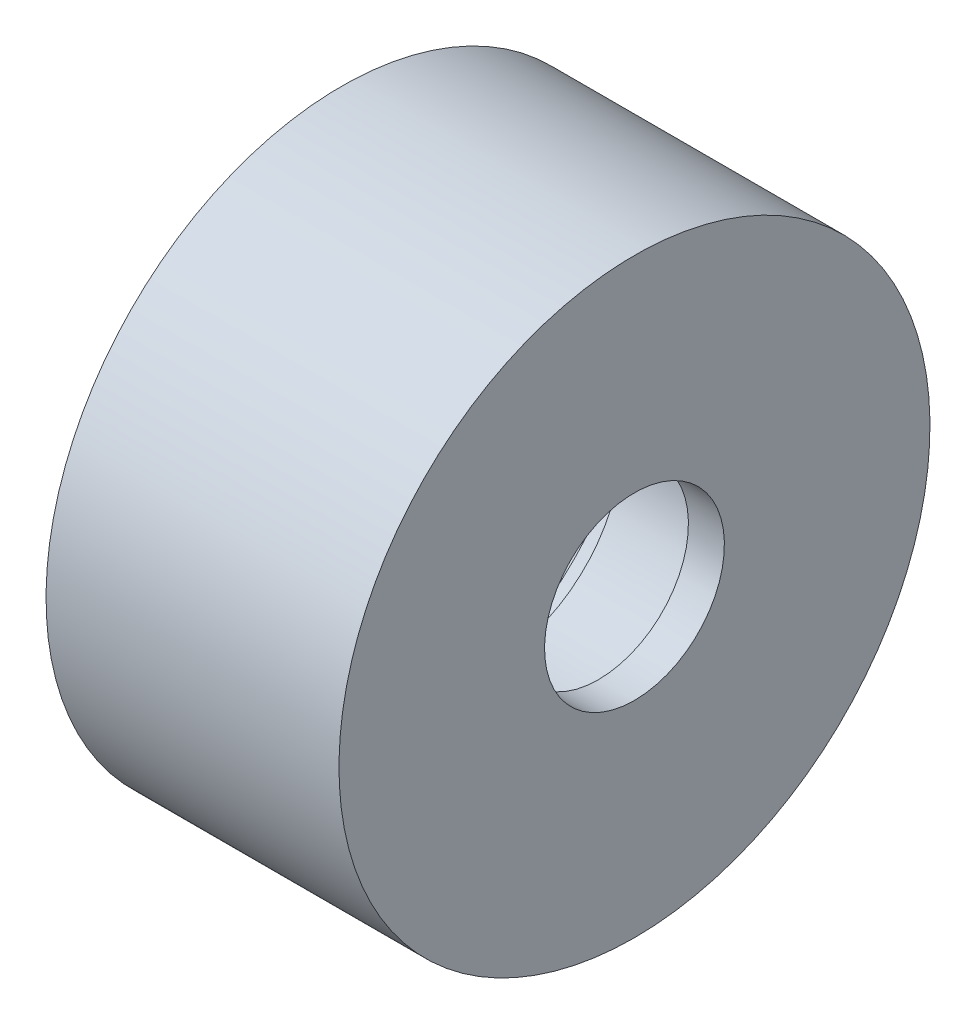
from build123d import *


with BuildPart() as part:
    # 草图1 → 旋转1 (revolve)
    with BuildSketch(Plane.XY, mode=Mode.PRIVATE) as revolve_1_sk:
        Polygon((-11.6, 6), (-11.6, 14), (-23, 14), (-23, 12), (-20, 13), (-20, 11), (-17, 11), (-17, 7.4), (-13, 7.4), (-13, 6), align=None)
    revolve(revolve_1_sk.sketch.rotate(Axis((-19.18351236, 2.5, 0), (1, 0, 0)), 180), axis=Axis((-19.18351236, 2.5, 0), (1, 0, 0)))


solid = part.part
